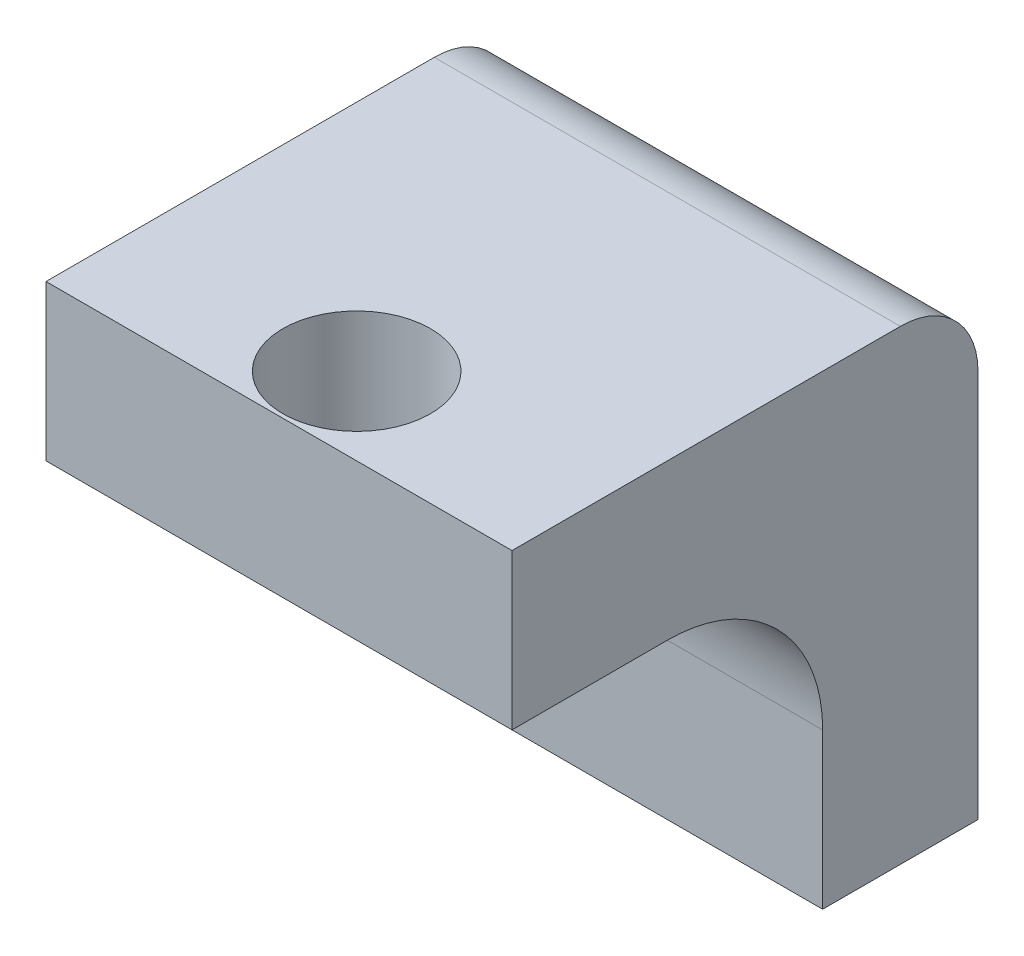
from build123d import *

# Parameters (mm, degrees)
SKETCH1_W           = 30
SKETCH1_H           = 30
BOSS_EXTRUDE3_DEPTH = 10
SKETCH2_W           = 20
SKETCH2_H           = 10
BOSS_EXTRUDE5_DEPTH = 30
FILLET1_R           = 10
SKETCH8_R           = 4.75
CUT_EXTRUDE6_DEPTH  = 47.904157598
FILLET3_R           = 5


with BuildPart() as part:
    # Sketch1 → Boss-Extrude3 (new body)
    with BuildSketch(Plane.XY):
        with Locations((15, 15)):
            Rectangle(SKETCH1_W, SKETCH1_H)
    extrude(amount=BOSS_EXTRUDE3_DEPTH)

    # Sketch2 → Boss-Extrude5 (add)
    with BuildSketch(Plane.ZY):
        with Locations((20, 25)):
            Rectangle(SKETCH2_W, SKETCH2_H)
    extrude(amount=-BOSS_EXTRUDE5_DEPTH)

    # Fillet1
    fillet1_edges = [part.edges().sort_by_distance(p)[0] for p in [
        (15, 20, 10),
    ]]
    fillet(fillet1_edges, radius=FILLET1_R)

    # Sketch8 → Cut-Extrude6 (cut, through all)
    with BuildSketch(Plane.XZ.offset(-20)):
        with Locations(Location((15, 25, 0), (0, 0, 270))):
            Circle(SKETCH8_R)
    extrude(amount=-CUT_EXTRUDE6_DEPTH, mode=Mode.SUBTRACT)

    # Fillet3
    fillet3_edges = [part.edges().sort_by_distance(p)[0] for p in [
        (15, 30, 0),
    ]]
    fillet(fillet3_edges, radius=FILLET3_R)


solid = part.part
